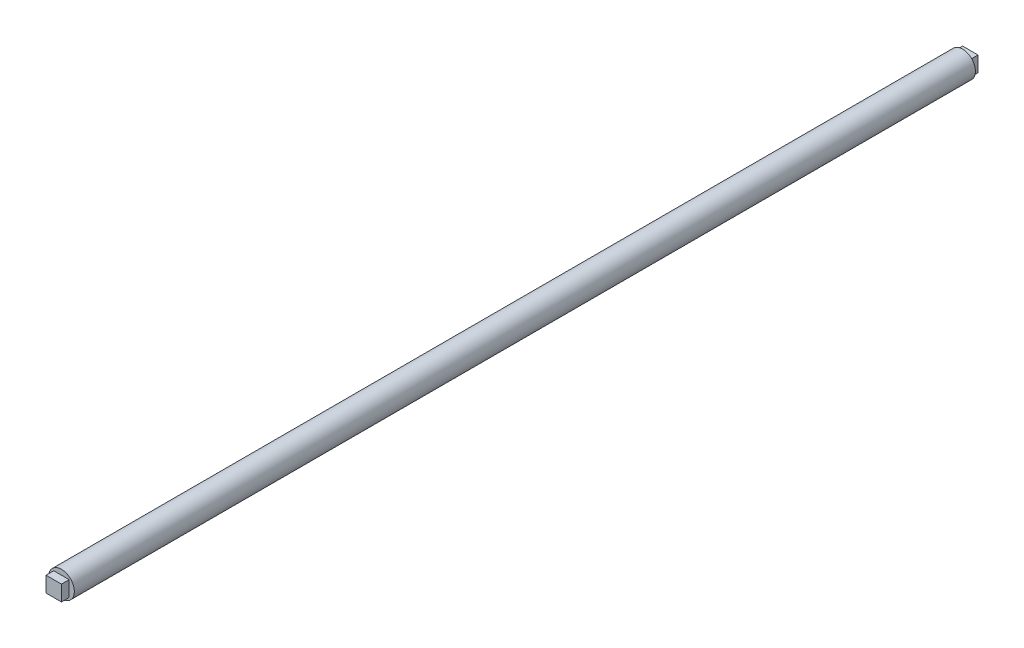
from build123d import *

# Parameters (mm, degrees)
SKETCH1_R           = 5
BOSS_EXTRUDE1_DEPTH = 175
SKETCH2_W           = 6
SKETCH2_H           = 6
BOSS_EXTRUDE2_DEPTH = 3


with BuildPart() as part:
    # Sketch1 → Boss-Extrude1 (new, symmetric)
    with BuildSketch(Plane.XY):
        Circle(SKETCH1_R)
    extrude(amount=BOSS_EXTRUDE1_DEPTH, both=True)

    # Sketch2 → Boss-Extrude2 (add)
    with BuildSketch(Plane.XY.offset(175)):
        Rectangle(SKETCH2_W, SKETCH2_H)
    boss_extrude2 = extrude(amount=BOSS_EXTRUDE2_DEPTH)

    # Mirror1: Boss-Extrude2 across plane
    add(boss_extrude2.mirror(Plane.XY))


solid = part.part
